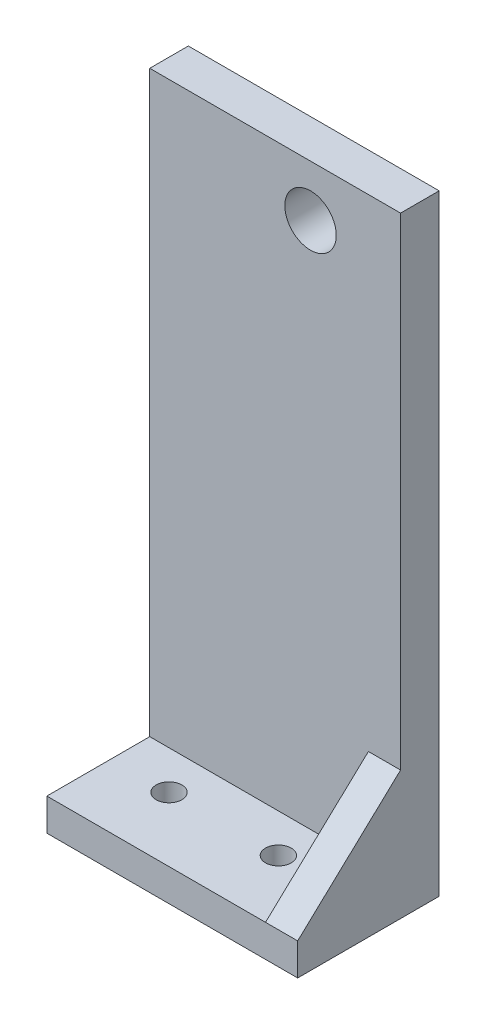
from build123d import *

# Parameters (mm, degrees)
SKETCH1_W           = 39
SKETCH1_H           = 22
SKETCH1_R           = 2
BOSS_EXTRUDE1_DEPTH = 5
SKETCH4_R           = 4
BOSS_EXTRUDE2_DEPTH = 6
BOSS_EXTRUDE3_DEPTH = 5


with BuildPart() as part:
    # Sketch1 → Boss-Extrude1 (new body)
    with BuildSketch(Plane(origin=(0, 0, 0), x_dir=(1, 0, 0), z_dir=(0, 1, 0))):
        with Locations((10.5, 1)):
            Rectangle(SKETCH1_W, SKETCH1_H)
        with Locations(Location((0, 0, 0), (0, 0, 270))):
            Circle(SKETCH1_R, mode=Mode.SUBTRACT)
        with Locations(Location((17, 0, 0), (0, 0, 270))):
            Circle(SKETCH1_R, mode=Mode.SUBTRACT)
    extrude(amount=BOSS_EXTRUDE1_DEPTH)

    # Sketch4 → Boss-Extrude2 (add)
    with BuildSketch(Plane(origin=(0, 0, -12), x_dir=(-1, 0, 0), z_dir=(0, 0, -1))):
        Polygon((-30, 5), (9, 5), (9, 15), (9, 95), (-30, 95), (-30, 15), align=None)
        with Locations((-16, 87)):
            Circle(SKETCH4_R, mode=Mode.SUBTRACT)
    extrude(amount=-BOSS_EXTRUDE2_DEPTH)

    # Sketch5 → Boss-Extrude3 (add)
    with BuildSketch(Plane(origin=(30, 0, 0), x_dir=(0, 0, -1), z_dir=(1, 0, 0))):
        Polygon((-10, 5), (6, 5), (6, 20), align=None)
    extrude(amount=-BOSS_EXTRUDE3_DEPTH)


solid = part.part
